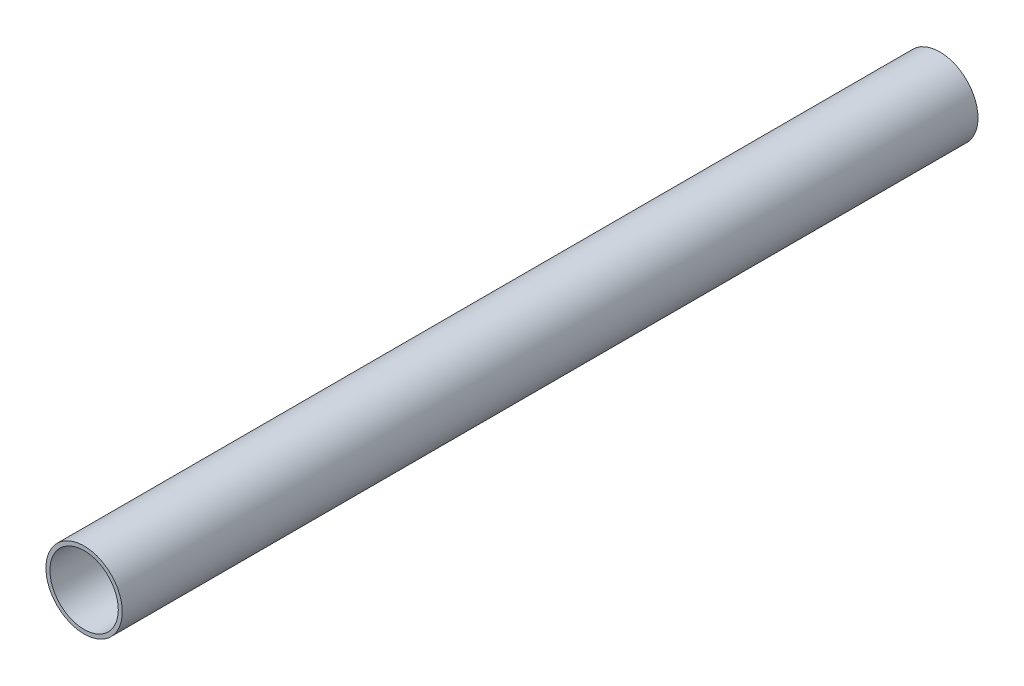
from build123d import *

# Parameters (mm, degrees)
SKETCH1_R           = 15.875
SKETCH1_R_2         = 14.224
BOSS_EXTRUDE1_DEPTH = 356


with BuildPart() as part:
    # Sketch1 → Boss-Extrude1 (new body)
    with BuildSketch(Plane.XY):
        Circle(SKETCH1_R)
        Circle(SKETCH1_R_2, mode=Mode.SUBTRACT)
    extrude(amount=BOSS_EXTRUDE1_DEPTH)


solid = part.part
